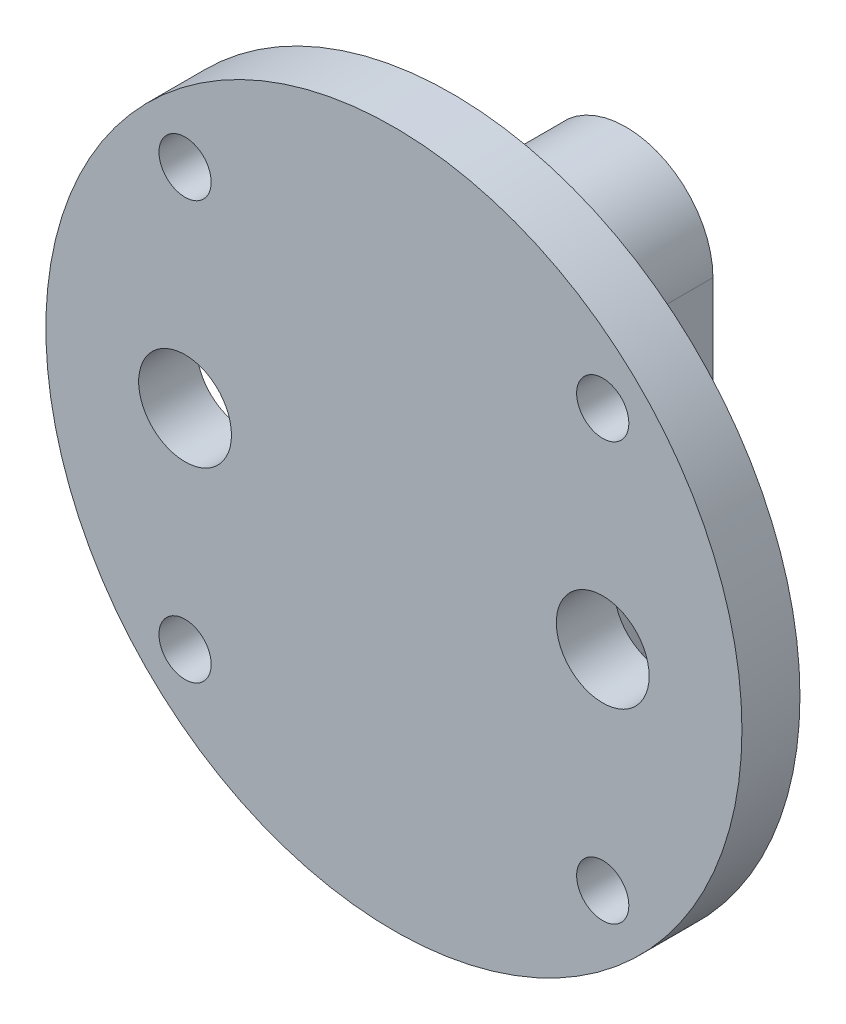
from build123d import *

# Parameters (mm, degrees)
ESQUISSE1_R        = 30
ESQUISSE1_R_2      = 2.25
ESQUISSE1_R_3      = 4
BOSS_EXTRU_1_DEPTH = 5
ESQUISSE2_R        = 2.8
BOSS_EXTRU_2_DEPTH = 15


with BuildPart() as part:
    # Esquisse1 → Boss.-Extru.1 (new body)
    with BuildSketch(Plane.XY):
        Circle(ESQUISSE1_R)
        with Locations((18, 18)):
            Circle(ESQUISSE1_R_2, mode=Mode.SUBTRACT)
        with Locations((-18, 18)):
            Circle(ESQUISSE1_R_2, mode=Mode.SUBTRACT)
        with Locations((-18, -18)):
            Circle(ESQUISSE1_R_2, mode=Mode.SUBTRACT)
        with Locations((18, -18)):
            Circle(ESQUISSE1_R_2, mode=Mode.SUBTRACT)
        with Locations((18, 0)):
            Circle(ESQUISSE1_R_3, mode=Mode.SUBTRACT)
        with Locations((-18, 0)):
            Circle(ESQUISSE1_R_3, mode=Mode.SUBTRACT)
    extrude(amount=BOSS_EXTRU_1_DEPTH)

    # Esquisse2 → Boss.-Extru.2 (add)
    with BuildSketch(Plane(origin=(0, 0, 0), x_dir=(-1, 0, 0), z_dir=(0, 0, -1))):
        with BuildLine():
            Line((7.5, 12.5), (7.5, -12.5))
            ThreePointArc((7.5, -12.5), (0, -20), (-7.5, -12.5))
            Line((-7.5, -12.5), (-7.5, 12.5))
            ThreePointArc((-7.5, 12.5), (0, 20), (7.5, 12.5))
        make_face()
        with Locations((0, 12.5)):
            Circle(ESQUISSE2_R, mode=Mode.SUBTRACT)
        with Locations((0, -12.5)):
            Circle(ESQUISSE2_R, mode=Mode.SUBTRACT)
    extrude(amount=BOSS_EXTRU_2_DEPTH)


solid = part.part
